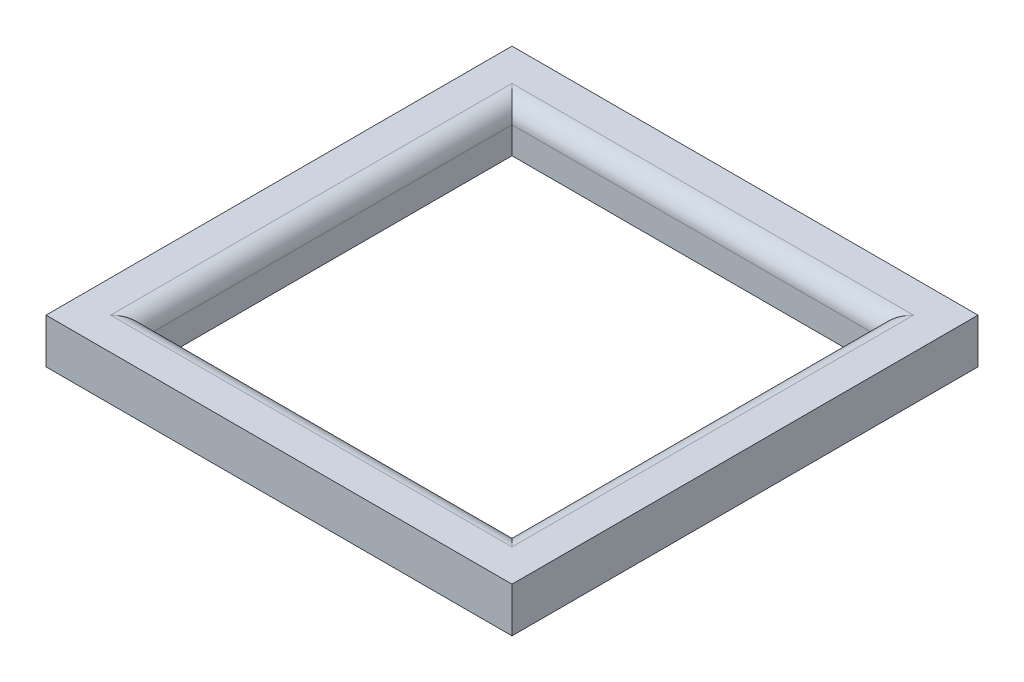
from build123d import *

# Parameters (mm, degrees)
SKETCH1_W           = 26
SKETCH1_H           = 26
SKETCH1_W_2         = 20.4
SKETCH1_H_2         = 20.4
BOSS_EXTRUDE1_DEPTH = 2.5
FILLET1_R           = 1


with BuildPart() as part:
    # Sketch1 → Boss-Extrude1 (new body)
    with BuildSketch(Plane(origin=(0, 0, 0), x_dir=(1, 0, 0), z_dir=(0, 1, 0))):
        Rectangle(SKETCH1_W, SKETCH1_H)
        Rectangle(SKETCH1_W_2, SKETCH1_H_2, mode=Mode.SUBTRACT)
    extrude(amount=BOSS_EXTRUDE1_DEPTH)

    # Fillet1
    fillet1_edges = [part.edges().sort_by_distance(p)[0] for p in [
        (10.2, 2.5, 0),
        (0, 2.5, -10.2),
        (-10.2, 2.5, 0),
        (0, 2.5, 10.2),
    ]]
    fillet(fillet1_edges, radius=FILLET1_R)


solid = part.part
